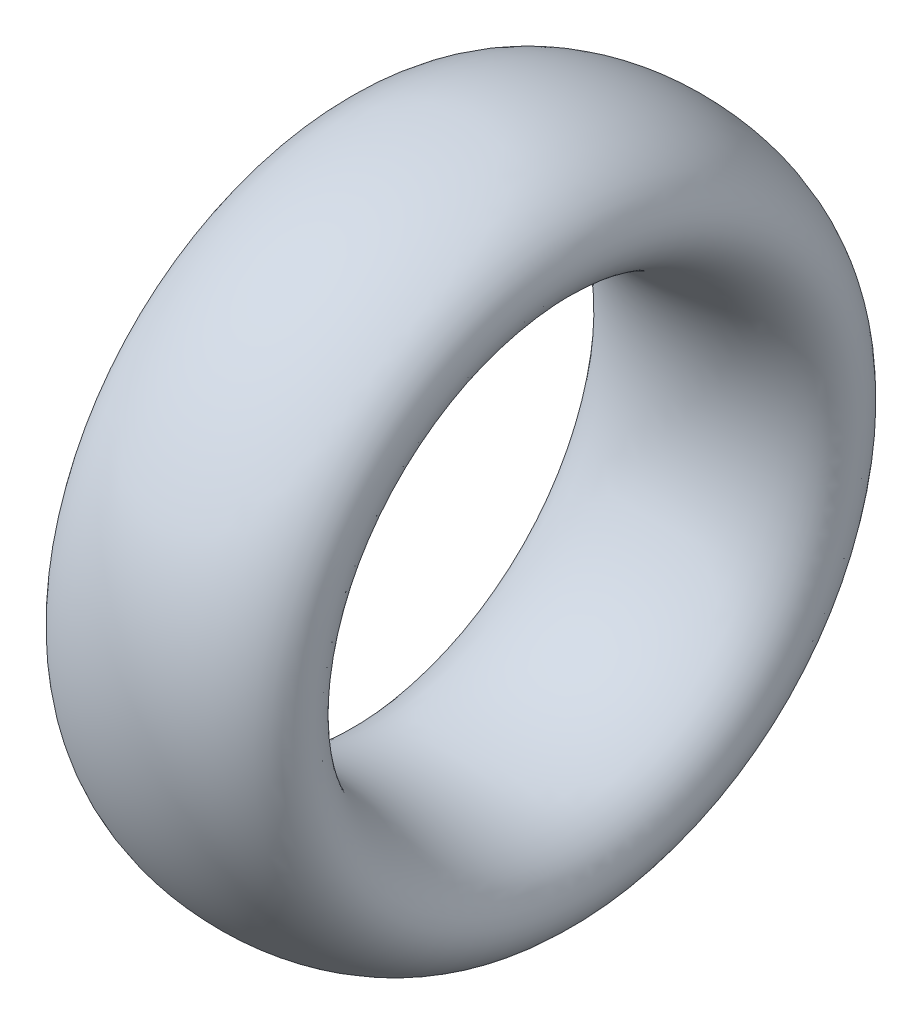
from build123d import *

# Parameters (mm, degrees)
SKICA1_RX = 1.2
SKICA1_RY = 0.65


with BuildPart() as part:
    # Skica1 → Otočit kolem osy1 (revolve)
    with BuildSketch(Plane.XY):
        with Locations(Location((1.2, 2.65), (0, 0, 180))):
            Ellipse(SKICA1_RX, SKICA1_RY)
    revolve(axis=Axis((0, 0, 0), (1, 0, 0)))


solid = part.part
